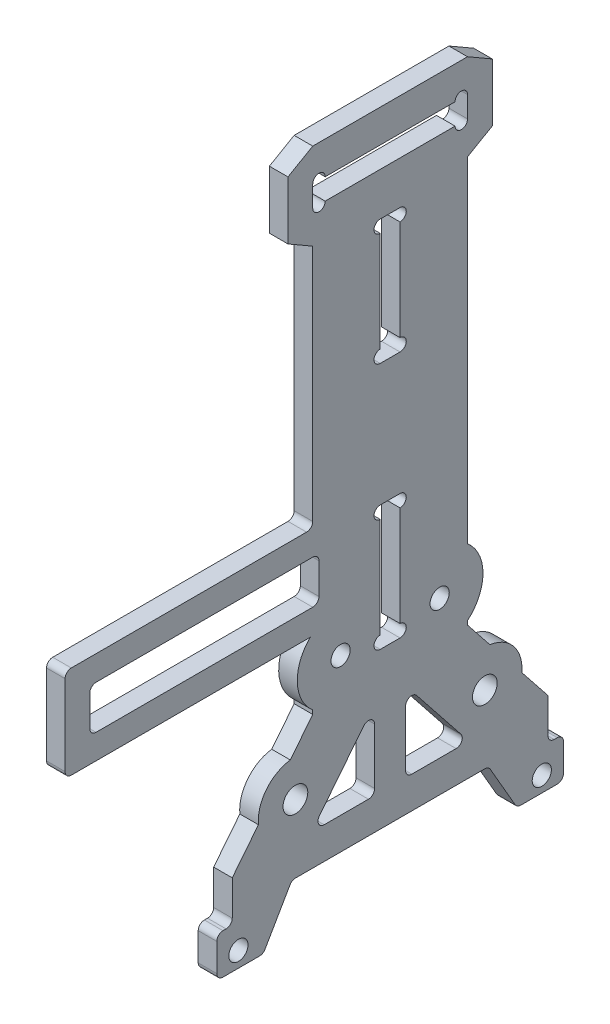
from build123d import *

# Parameters (mm, degrees)
SKETCH_1_R          = 1.55
SKETCH_1_W          = 37
SKETCH_1_H          = 7
EXTRUDE_1_DEPTH     = 3
SKETCH_2_R          = 2
CUT_EXTRUDE_1_DEPTH = 10
EXTRUDE_START       = -3
SKETCH_3_R          = 1.55
EXTRUDE_2_DEPTH     = 3
FILLET_1_R          = 1


with BuildPart() as part:
    # 草图1 → 凸台-拉伸1 (new body)
    # profile 1 of 2: a face of its own
    with BuildSketch(Plane(origin=(0, 0, 0), x_dir=(0, 0, -1), z_dir=(1, 0, 0))):
        Polygon((28, -59.25), (12.5, -39.75), (-12.5, -39.75), (-28, -59.25), (-28, -69.25), (-20.5, -69.25), (-15.881197846, -61.25), (15.881197846, -61.25), (20.5, -69.25), (28, -69.25), align=None)
        with Locations((-24.5, -66.75)):
            Circle(SKETCH_1_R, mode=Mode.SUBTRACT)
        with Locations((24.5, -66.75)):
            Circle(SKETCH_1_R, mode=Mode.SUBTRACT)
    # profile 2 of 2: a face of its own
    with BuildSketch(Plane(origin=(0, 0, 0), x_dir=(0, 0, -1), z_dir=(1, 0, 0))):
        Polygon((-12.5, -39.75), (12.5, -39.75), (12.5, -28.75), (12.5, -13.75), (12.5, 25.75), (16.5, 28.059401077), (16.5, 37.440598923), (12.5, 39.75), (-12.5, 39.75), (-16.5, 37.440598923), (-16.5, 28.059401077), (-12.5, 25.75), (-12.5, -13.75), (-52.5, -13.75), (-52.5, -28.75), (-12.5, -28.75), align=None)
        with Locations((-30, -21.25)):
            Rectangle(SKETCH_1_W, SKETCH_1_H, mode=Mode.SUBTRACT)
        with Locations((-8, -33.75)):
            Circle(SKETCH_1_R, mode=Mode.SUBTRACT)
        with BuildLine():
            ThreePointArc((2.605, -35.095), (2.310642315, -35.805642315), (1.6, -36.1))
            Line((1.6, -36.1), (-1.6, -36.1))
            ThreePointArc((-1.6, -36.1), (-2.605, -35.095), (-1.6, -34.09))
            Line((-1.6, -34.09), (-1.6, -17.91))
            ThreePointArc((-1.6, -17.91), (-2.605, -16.905), (-1.6, -15.9))
            Line((-1.6, -15.9), (1.6, -15.9))
            ThreePointArc((1.6, -15.9), (2.310642315, -16.194357685), (2.605, -16.905))
            ThreePointArc((2.605, -16.905), (2.310642315, -17.615642315), (1.6, -17.91))
            Line((1.6, -17.91), (1.6, -34.09))
            ThreePointArc((1.6, -34.09), (2.310642315, -34.384357685), (2.605, -35.095))
        make_face(mode=Mode.SUBTRACT)
        with Locations((8, -33.75)):
            Circle(SKETCH_1_R, mode=Mode.SUBTRACT)
        with BuildLine():
            ThreePointArc((2.605, 4.905), (2.310642315, 4.194357685), (1.6, 3.9))
            Line((1.6, 3.9), (-1.6, 3.9))
            ThreePointArc((-1.6, 3.9), (-2.605, 4.905), (-1.6, 5.91))
            Line((-1.6, 5.91), (-1.6, 22.09))
            ThreePointArc((-1.6, 22.09), (-2.605, 23.095), (-1.6, 24.1))
            Line((-1.6, 24.1), (1.6, 24.1))
            ThreePointArc((1.6, 24.1), (2.310642315, 23.805642315), (2.605, 23.095))
            ThreePointArc((2.605, 23.095), (2.310642315, 22.384357685), (1.6, 22.09))
            Line((1.6, 22.09), (1.6, 5.91))
            ThreePointArc((1.6, 5.91), (2.310642315, 5.615642315), (2.605, 4.905))
        make_face(mode=Mode.SUBTRACT)
        with BuildLine():
            Line((10.49, 31.05), (-10.49, 31.05))
            ThreePointArc((-10.49, 31.05), (-11.495, 30.045), (-12.5, 31.05))
            Line((-12.5, 31.05), (-12.5, 34.45))
            ThreePointArc((-12.5, 34.45), (-11.495, 35.455), (-10.49, 34.45))
            Line((-10.49, 34.45), (10.49, 34.45))
            ThreePointArc((10.49, 34.45), (11.495, 35.455), (12.5, 34.45))
            Line((12.5, 34.45), (12.5, 31.05))
            ThreePointArc((12.5, 31.05), (11.495, 30.045), (10.49, 31.05))
        make_face(mode=Mode.SUBTRACT)
    extrude(amount=EXTRUDE_1_DEPTH)

    # 草图2 → 切除-拉伸1 (cut)
    with BuildSketch(Plane(origin=(3, 0, 0), x_dir=(0, 0, -1), z_dir=(1, 0, 0))):
        with Locations((15.3, -50.25)):
            Circle(SKETCH_2_R)
        with Locations((-15.3, -50.25)):
            Circle(SKETCH_2_R)
        Polygon((33.5, -57.75), (33.5, -62.75), (25.5, -62.75), (25.5, -57.75), (25.5, -56.10483871), (33.5, -56.10483871), align=None)
        Polygon((-33.5, -62.75), (-25.5, -62.75), (-25.5, -57.75), (-25.5, -56.10483871), (-33.5, -56.10483871), (-33.5, -57.75), align=None)
        Polygon((12.725724403, -56.10483871), (2.5, -56.10483871), (2.5, -43.240217687), align=None)
        Polygon((-2.5, -56.10483871), (-2.5, -43.240217687), (-12.725724403, -56.10483871), align=None)
    extrude(amount=-CUT_EXTRUDE_1_DEPTH, mode=Mode.SUBTRACT)

    # 草图3 → 凸台-拉伸2 (add)
    # profile 1 of 4: a face of its own
    with BuildSketch(Plane(origin=(3, 0, 0), x_dir=(0, 0, -1), z_dir=(1, 0, 0)).offset(EXTRUDE_START)):
        with BuildLine():
            Line((-3.757359313, -27.75), (-11.605551275, -27.75))
            ThreePointArc((-11.605551275, -27.75), (-13.792647393, -37.680042771), (-3.757359313, -39.317764363))
            Line((-3.757359313, -39.317764363), (-3.757359313, -27.75))
        make_face()
        with Locations((-8, -33.75)):
            Circle(SKETCH_3_R, mode=Mode.SUBTRACT)
    # profile 2 of 4: a face of its own
    with BuildSketch(Plane(origin=(3, 0, 0), x_dir=(0, 0, -1), z_dir=(1, 0, 0)).offset(EXTRUDE_START)):
        with BuildLine():
            Line((11.605551275, -27.75), (3.757359313, -27.75))
            Line((3.757359313, -27.75), (3.757359313, -39.317764363))
            ThreePointArc((3.757359313, -39.317764363), (13.792647393, -37.680042771), (11.605551275, -27.75))
        make_face()
        with Locations((8, -33.75)):
            Circle(SKETCH_3_R, mode=Mode.SUBTRACT)
    # profile 3 of 4: a face of its own
    with BuildSketch(Plane(origin=(3, 0, 0), x_dir=(0, 0, -1), z_dir=(1, 0, 0)).offset(EXTRUDE_START)):
        with BuildLine():
            Line((-21.275623434, -50.790300449), (-16.121878581, -44.306556924))
            ThreePointArc((-16.121878581, -44.306556924), (-19.996939529, -46.516535247), (-21.275623434, -50.790300449))
        make_face()
    # profile 4 of 4: a face of its own
    with BuildSketch(Plane(origin=(3, 0, 0), x_dir=(0, 0, -1), z_dir=(1, 0, 0)).offset(EXTRUDE_START)):
        with BuildLine():
            Line((21.275623434, -50.790300449), (16.121878581, -44.306556924))
            ThreePointArc((16.121878581, -44.306556924), (19.996939529, -46.516535247), (21.275623434, -50.790300449))
        make_face()
    extrude(amount=EXTRUDE_2_DEPTH)

    # 圆角1
    fillet_1_edges = [part.edges().sort_by_distance(p)[0] for p in [
        (1.5, -17.75, 48.5),
        (1.5, -24.75, 48.5),
        (1.5, -24.75, 11.5),
        (1.5, -17.75, 11.5),
        (1.5, -62.75, -25.5),
        (1.5, -62.75, -28),
        (1.5, -56.10483871, 12.725724403),
        (1.5, -43.240217687, 2.5),
        (1.5, -56.10483871, 2.5),
        (1.5, -62.75, 28),
        (1.5, -62.75, 25.5),
        (1.5, -43.240217687, -2.5),
        (1.5, -56.10483871, -12.725724403),
        (1.5, -56.10483871, -2.5),
        (1.5, -69.25, -28),
        (1.5, -69.25, -20.5),
        (1.5, -61.25, -15.881197846),
        (1.5, -61.25, 15.881197846),
        (1.5, -69.25, 20.5),
        (1.5, -69.25, 28),
        (1.5, -28.75, 52.5),
        (1.5, -13.75, 52.5),
        (1.5, -13.75, 12.5),
    ]]
    fillet(fillet_1_edges, radius=FILLET_1_R)


solid = part.part
